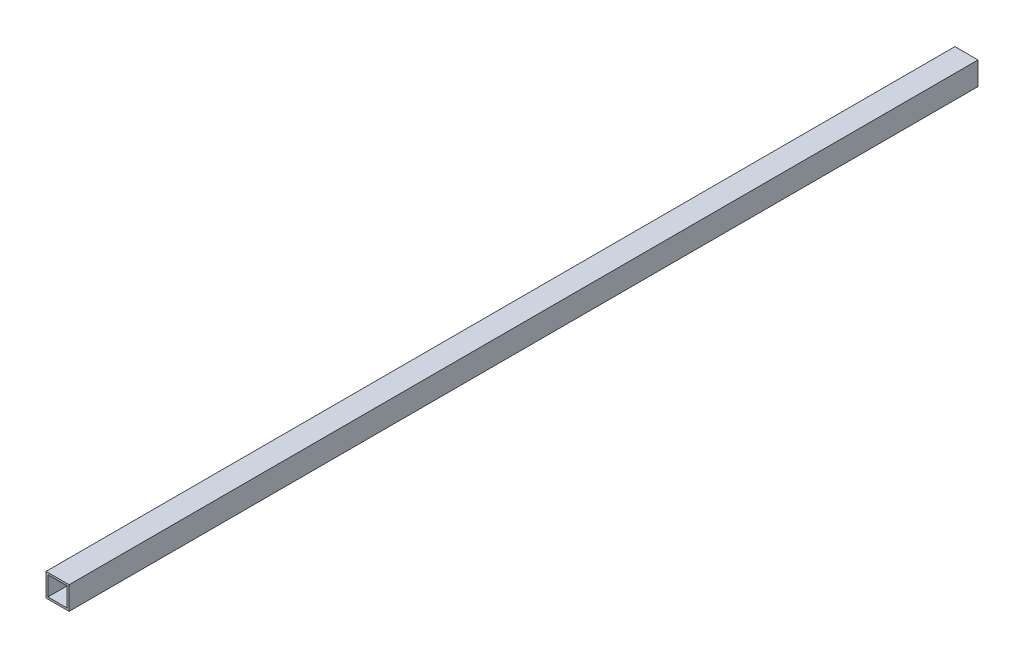
from build123d import *

# Parameters (mm, degrees)
BOSS_EXTRUDE1_DEPTH = 609.6
SKETCH3_R           = 4.5
CUT_EXTRUDE1_DEPTH  = 10
SKETCH6_W           = 34.925
SKETCH6_H           = 3.175
BOSS_EXTRUDE2_DEPTH = 890.4
SKETCH7_W           = 3.175
SKETCH7_H           = 38.1
BOSS_EXTRUDE3_DEPTH = 1500


with BuildPart() as part:
    # Sketch2 → Boss-Extrude1 (new body)
    with BuildSketch(Plane.XY):
        Polygon((-15.875, -15.875), (-19.05, -15.875), (-19.05, -19.05), (19.05, -19.05), (19.05, 19.05), (-19.05, 19.05), (-19.05, 15.875), (-15.875, 15.875), (15.875, 15.875), (15.875, -15.875), align=None)
    extrude(amount=BOSS_EXTRUDE1_DEPTH)

    # Sketch3 → Cut-Extrude1 (cut)
    with BuildSketch(Plane.XZ.offset(19.05)):
        with Locations(Location((0, 574.6, 0), (0, 0, 270))):
            Circle(SKETCH3_R)
        with Locations(Location((0, 539.6, 0), (0, 0, 270))):
            Circle(SKETCH3_R)
        with Locations(Location((0, 469.6, 0), (0, 0, 270))):
            Circle(SKETCH3_R)
        with Locations(Location((0, 504.6, 0), (0, 0, 270))):
            Circle(SKETCH3_R)
    extrude(amount=-CUT_EXTRUDE1_DEPTH, mode=Mode.SUBTRACT)

    # Sketch6 → Boss-Extrude2 (add)
    with BuildSketch(Plane(origin=(0, 0, 0), x_dir=(-1, 0, 0), z_dir=(0, 0, -1))):
        Polygon((19.05, -15.875), (-15.875, -15.875), (-19.05, -15.875), (-19.05, -19.05), (19.05, -19.05), align=None)
        Polygon((-15.875, 15.875), (-15.875, 19.05), (-19.05, 19.05), (-19.05, -15.875), (-15.875, -15.875), align=None)
        with Locations((1.5875, 17.4625)):
            Rectangle(SKETCH6_W, SKETCH6_H)
    extrude(amount=BOSS_EXTRUDE2_DEPTH)

    # Sketch7 → Boss-Extrude3 (add)
    with BuildSketch(Plane.XY.offset(609.6)):
        with Locations((-17.4625, 0)):
            Rectangle(SKETCH7_W, SKETCH7_H)
    extrude(amount=-BOSS_EXTRUDE3_DEPTH)


solid = part.part
